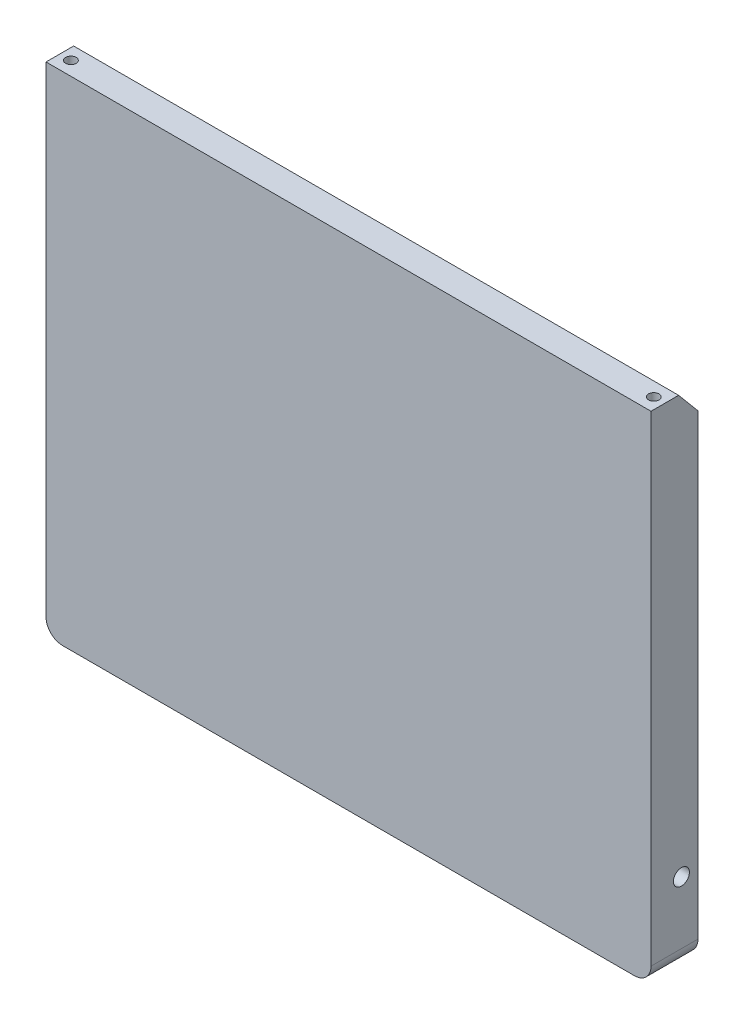
from build123d import *

# Parameters (mm, degrees)
SKETCH1_W           = 109.52
SKETCH1_H           = 90
BOSS_EXTRUDE1_DEPTH = 5
SKETCH2_R           = 0.95
CUT_EXTRUDE1_DEPTH  = 7
FILLET1_R           = 3
BOSS_EXTRUDE2_DEPTH = 3.5
CHAMFER1_SIZE       = 3.5
CHAMFER1_SIZE2      = 4.171137574
SKETCH5_W           = 100.2
SKETCH5_H           = 79.2
CUT_EXTRUDE3_DEPTH  = 6.5
SKETCH8_R           = 1.45
CUT_EXTRUDE5_DEPTH  = 3


with BuildPart() as part:
    # Sketch1 → Boss-Extrude1 (new body)
    with BuildSketch(Plane.XY):
        with Locations((49.453432203, -35.801949153)):
            Rectangle(SKETCH1_W, SKETCH1_H)
    extrude(amount=BOSS_EXTRUDE1_DEPTH)

    # Sketch2 → Cut-Extrude1 (cut)
    with BuildSketch(Plane(origin=(0, 9.198050847, 0), x_dir=(1, 0, 0), z_dir=(0, 1, 0))):
        with Locations(Location((-3.306567797, -2.5, 0), (0, 0, 270))):
            Circle(SKETCH2_R)
        with Locations(Location((102.213432203, -2.5, 0), (0, 0, 270))):
            Circle(SKETCH2_R)
    extrude(amount=-CUT_EXTRUDE1_DEPTH, mode=Mode.SUBTRACT)

    # Fillet1
    fillet1_edges = [part.edges().sort_by_distance(p)[0] for p in [
        (104.213432203, -80.801949153, 2.5),
        (-5.306567797, -80.801949153, 2.5),
    ]]
    fillet(fillet1_edges, radius=FILLET1_R)

    # Sketch4 → Boss-Extrude2 (add)
    with BuildSketch(Plane(origin=(0, 0, 0), x_dir=(-1, 0, 0), z_dir=(0, 0, -1))):
        with BuildLine():
            Line((-104.213432203, 9.198050847), (-104.213432203, -77.801949153))
            ThreePointArc((-104.213432203, -77.801949153), (-103.334752547, -79.923269496), (-101.213432203, -80.801949153))
            Line((-101.213432203, -80.801949153), (2.306567797, -80.801949153))
            ThreePointArc((2.306567797, -80.801949153), (4.42788814, -79.923269496), (5.306567797, -77.801949153))
            Line((5.306567797, -77.801949153), (5.306567797, 9.198050847))
            Line((5.306567797, 9.198050847), (-104.213432203, 9.198050847))
        make_face()
    extrude(amount=BOSS_EXTRUDE2_DEPTH)

    # Chamfer1
    chamfer1_edges = [part.edges().sort_by_distance(p)[0] for p in [
        (49.453432203, 9.198050847, -3.5),
    ]]
    chamfer1_side = [part.faces().sort_by_distance(p)[0] for p in [
        (49.453432203, 9.198050847, 0.739274778),
    ]]
    chamfer(chamfer1_edges, length=CHAMFER1_SIZE, length2=CHAMFER1_SIZE2, reference=chamfer1_side[0])

    # Sketch5 → Cut-Extrude3 (cut)
    with BuildSketch(Plane(origin=(0, 0, -3.5), x_dir=(-1, 0, 0), z_dir=(0, 0, -1))):
        with Locations((-49.453432203, -35.801949153)):
            Rectangle(SKETCH5_W, SKETCH5_H)
    extrude(amount=-CUT_EXTRUDE3_DEPTH, mode=Mode.SUBTRACT)

    # Sketch8 → Cut-Extrude5 (cut)
    with BuildSketch(Plane(origin=(104.213432203, 0, 0), x_dir=(0, 0, -1), z_dir=(1, 0, 0))):
        with Locations((0.5, -66.551949153)):
            Circle(SKETCH8_R)
    cut_extrude5 = extrude(amount=-CUT_EXTRUDE5_DEPTH, mode=Mode.SUBTRACT)

    # Mirror2: Cut-Extrude5 across plane
    add(cut_extrude5.mirror(Plane.ZY.offset(-49.453432203)), mode=Mode.SUBTRACT)


solid = part.part
